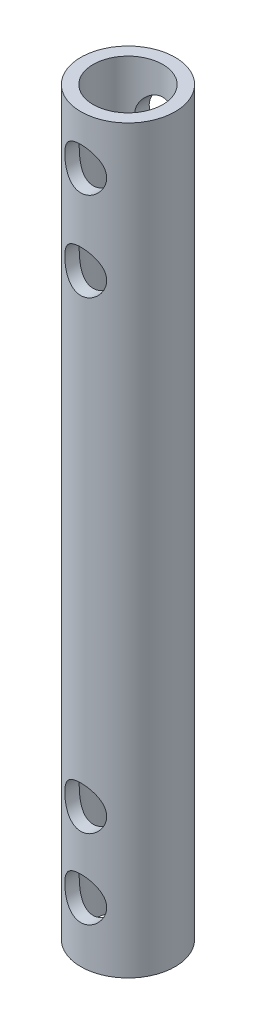
from build123d import *

# Parameters (mm, degrees)
SKETCH1_R               = 9.55
SKETCH1_R_2             = 7.05
BOSS_EXTRUDE1_DEPTH     = 150
CUT_EXTRUDE1_DEPTH      = 151.606789356
CUT_EXTRUDE1_DEPTH_BACK = 151.606789356
SKETCH2_R               = 4.25


with BuildPart() as part:
    # Sketch1 → Boss-Extrude1 (new body)
    with BuildSketch(Plane(origin=(0, 0, 0), x_dir=(1, 0, 0), z_dir=(0, 1, 0))):
        with Locations(Location((0, 0, 0), (0, 0, 270))):
            Circle(SKETCH1_R)
        with Locations(Location((0, 0, 0), (0, 0, 270))):
            Circle(SKETCH1_R_2, mode=Mode.SUBTRACT)
    extrude(amount=BOSS_EXTRUDE1_DEPTH)

    # Sketch2 → Cut-Extrude1 (cut, two sides: drawn at the far end of the back side and taken through both)
    with BuildSketch(Plane.XY.offset(-CUT_EXTRUDE1_DEPTH_BACK)):
        with Locations((0, 12)):
            Circle(SKETCH2_R)
        with Locations((0, 28)):
            Circle(SKETCH2_R)
        with Locations((0, 122)):
            Circle(SKETCH2_R)
        with Locations((0, 140)):
            Circle(SKETCH2_R)
    extrude(amount=CUT_EXTRUDE1_DEPTH + CUT_EXTRUDE1_DEPTH_BACK, mode=Mode.SUBTRACT)


solid = part.part
